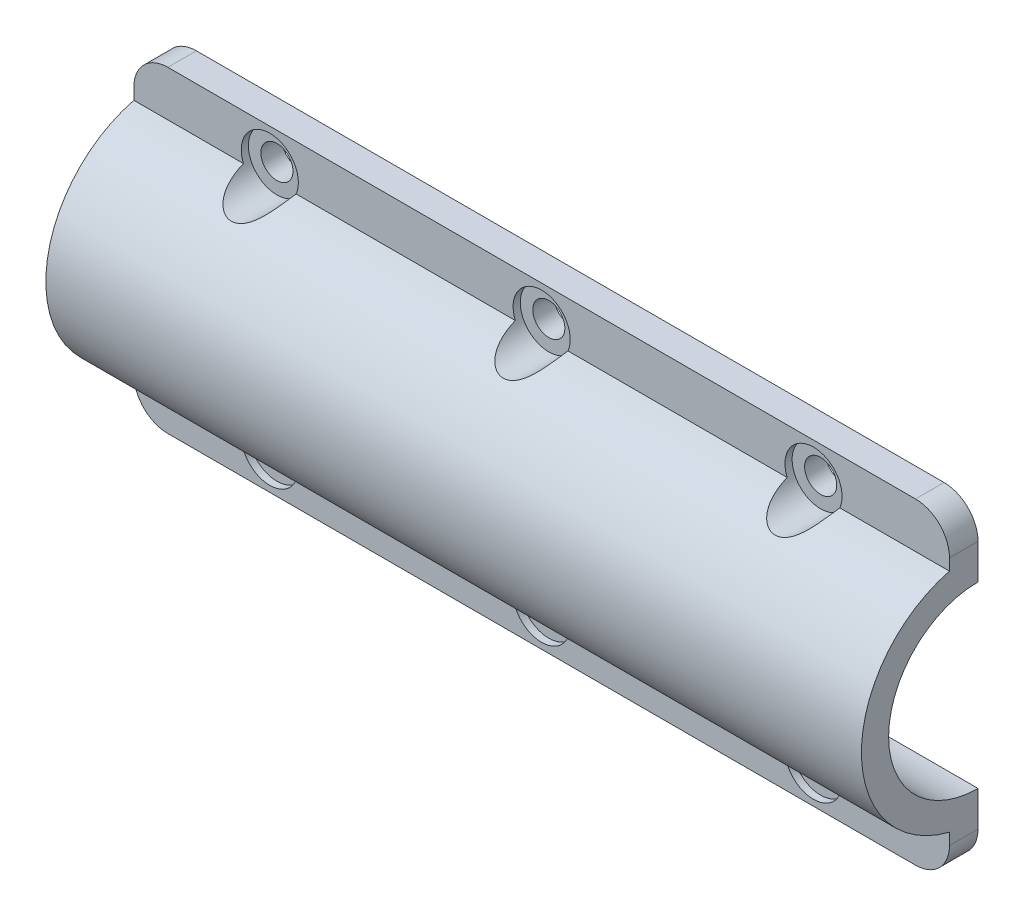
from build123d import *

# Parameters (mm, degrees)
BOSS_EXTRUDE1_DEPTH  = 114.3
CUT_EXTRUDE1_START   = -1
SKETCH2_R            = 4
CUT_EXTRUDE1_DEPTH   = 7.35
M4_CLEARANCE_HOLE1_D = 4.5
FILLET1_R            = 4.7625


with BuildPart() as part:
    # Sketch1 → Boss-Extrude1 (new body)
    with BuildSketch(Plane(origin=(0, 0, 0), x_dir=(0, 0, -1), z_dir=(1, 0, 0))):
        with BuildLine():
            Line((0, 22.225), (-4, 22.225))
            Line((-4, 22.225), (-4, 15.839643355))
            ThreePointArc((-4, 15.839643355), (-2.015394761, 16.212109226), (0, 16.3369))
            Line((0, 16.3369), (0, 17.4625))
            Line((0, 17.4625), (0, 22.225))
        make_face()
        with BuildLine():
            ThreePointArc((0, 16.3369), (-2.015394761, 16.212109226), (-4, 15.839643355))
            ThreePointArc((-4, 15.839643355), (-16.3369, 0), (-4, -15.839643355))
            ThreePointArc((-4, -15.839643355), (-2.015394761, -16.212109226), (0, -16.3369))
            Line((0, -16.3369), (0, -12.5269))
            ThreePointArc((0, -12.5269), (-12.361865073, -2.026700652), (-4, 11.871108778))
            ThreePointArc((-4, 11.871108778), (-2.026700652, 12.361865073), (0, 12.5269))
            Line((0, 12.5269), (0, 16.3369))
        make_face()
        with BuildLine():
            ThreePointArc((0, -16.3369), (-2.015394761, -16.212109226), (-4, -15.839643355))
            Line((-4, -15.839643355), (-4, -22.225))
            Line((-4, -22.225), (0, -22.225))
            Line((0, -22.225), (0, -17.4625))
            Line((0, -17.4625), (0, -16.3369))
        make_face()
    extrude(amount=BOSS_EXTRUDE1_DEPTH)

    # Sketch2 → Cut-Extrude1 (cut)
    with BuildSketch(Plane.XY.offset(4).offset(CUT_EXTRUDE1_START)):
        with Locations(Location((19.05, -17.37595, 0), (0, 0, 157.413569777))):
            Circle(SKETCH2_R)
        with Locations(Location((57.15, -17.37595, 0), (0, 0, 157.413569777))):
            Circle(SKETCH2_R)
        with Locations(Location((95.25, -17.37595, 0), (0, 0, 157.413569777))):
            Circle(SKETCH2_R)
    cut_extrude1 = extrude(amount=CUT_EXTRUDE1_DEPTH, mode=Mode.SUBTRACT)

    # M4 Clearance Hole1 (through all)
    with Locations(Plane.XY.offset(4)):
        with Locations((19.05, -17.37595), (57.15, -17.37595), (95.25, -17.37595)):
            m4_clearance_hole1 = Hole(M4_CLEARANCE_HOLE1_D / 2)

    # Mirror1: Cut-Extrude1, M4 Clearance Hole1 across plane
    add(cut_extrude1.mirror(Plane.ZX), mode=Mode.SUBTRACT)
    add(m4_clearance_hole1.mirror(Plane.ZX), mode=Mode.SUBTRACT)

    # Fillet1
    fillet1_edges = [part.edges().sort_by_distance(p)[0] for p in [
        (0, 22.225, 2),
        (0, -22.225, 2),
        (114.3, -22.225, 2),
        (114.3, 22.225, 2),
    ]]
    fillet(fillet1_edges, radius=FILLET1_R)


solid = part.part
